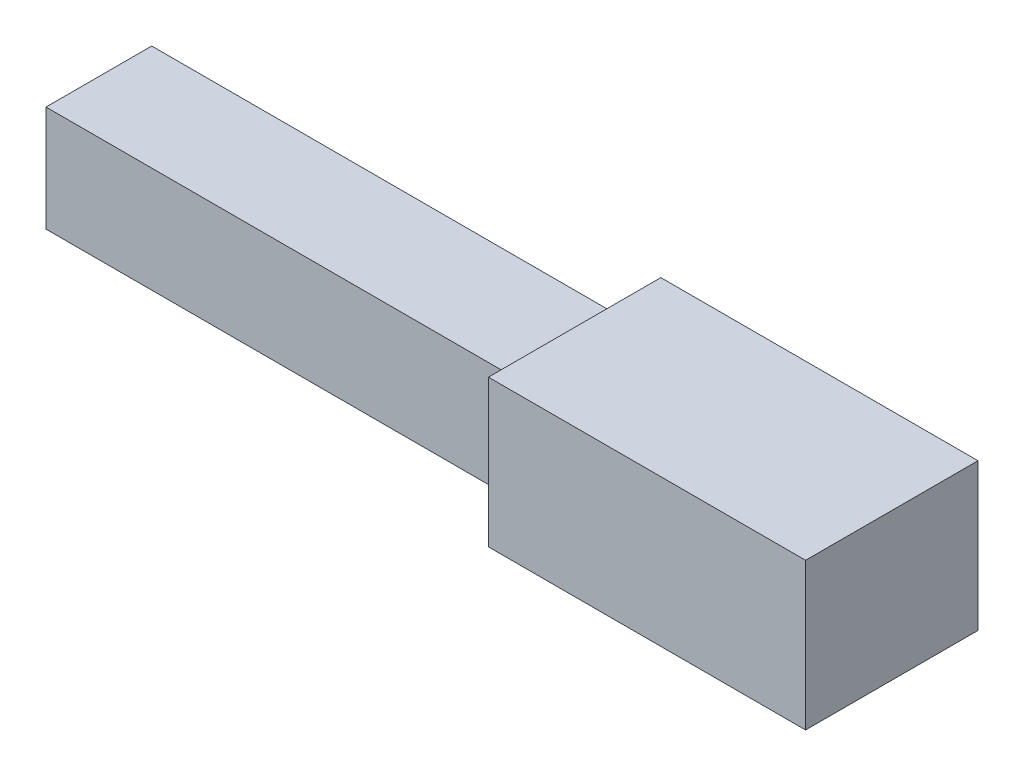
from build123d import *

# Parameters (mm, degrees)
CROQUIS1_W              = 40
CROQUIS1_H              = 40
SALIENTE_EXTRUIR1_DEPTH = 180
CROQUIS2_W              = 65.229189802
CROQUIS2_H              = 55.611462232
SALIENTE_EXTRUIR2_DEPTH = 120


with BuildPart() as part:
    # Croquis1 → Saliente-Extruir1 (new body)
    with BuildSketch(Plane(origin=(0, 0, 0), x_dir=(0, 0, -1), z_dir=(1, 0, 0))):
        with Locations((20, 20)):
            Rectangle(CROQUIS1_W, CROQUIS1_H)
    extrude(amount=SALIENTE_EXTRUIR1_DEPTH)

    # Croquis2 → Saliente-Extruir2 (add)
    with BuildSketch(Plane(origin=(180, 0, 0), x_dir=(0, 0, -1), z_dir=(1, 0, 0))):
        with Locations((20, 20)):
            Rectangle(CROQUIS2_W, CROQUIS2_H)
    extrude(amount=SALIENTE_EXTRUIR2_DEPTH)


solid = part.part
